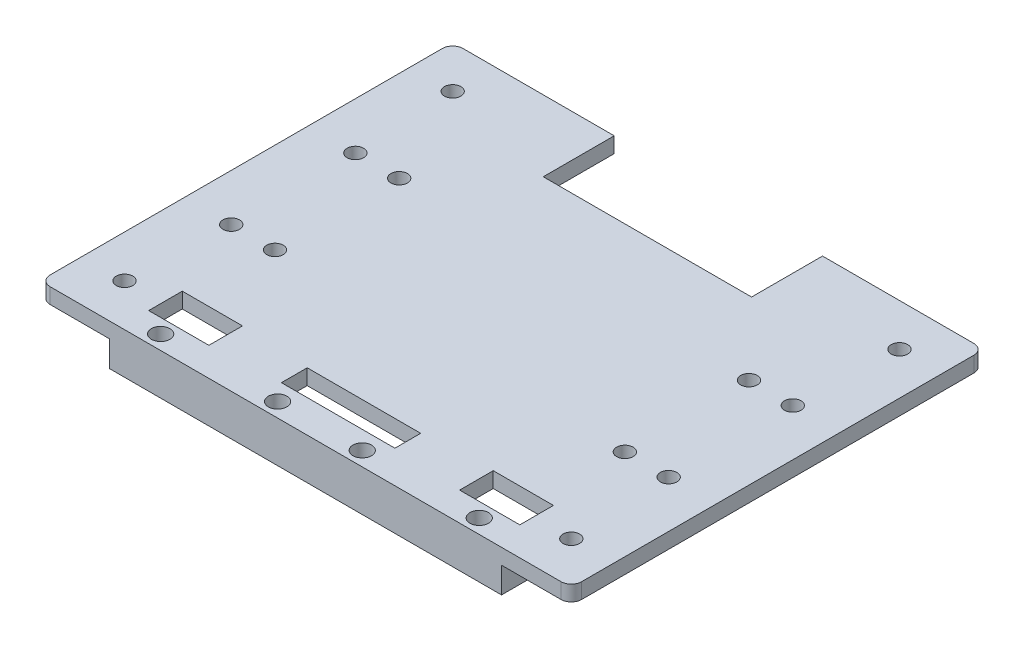
from build123d import *

# Parameters (mm, degrees)
SKETCH_1_R          = 1.6
SKETCH_1_W          = 11.667697598
SKETCH_1_H          = 6.517356375
SKETCH_1_W_2        = 22
SKETCH_1_H_2        = 5
EXTRUDE_1_DEPTH     = 3
SKETCH_2_W          = 75.93825213
SKETCH_2_H          = 5.545458332
EXTRUDE_2_DEPTH     = 8
SKETCH_3_R          = 1.8
CUT_EXTRUDE_1_DEPTH = 15


with BuildPart() as part:
    # 草图1 → 凸台-拉伸1 (new body)
    with BuildSketch(Plane(origin=(0, 0, 0), x_dir=(1, 0, 0), z_dir=(0, 1, 0))):
        with BuildLine():
            Line((-49.5, -40), (49.5, -40))
            ThreePointArc((49.5, -40), (50.914213562, -39.414213562), (51.5, -38))
            Line((51.5, -38), (51.5, 38))
            ThreePointArc((51.5, 38), (50.914213562, 39.414213562), (49.5, 40))
            Line((49.5, 40), (20.187430173, 40))
            Line((20.187430173, 40), (20.187430173, 26.249140852))
            Line((20.187430173, 26.249140852), (-20.187430173, 26.249140852))
            Line((-20.187430173, 26.249140852), (-20.187430173, 40))
            Line((-20.187430173, 40), (-49.5, 40))
            ThreePointArc((-49.5, 40), (-50.914213562, 39.414213562), (-51.5, 38))
            Line((-51.5, 38), (-51.5, -38))
            ThreePointArc((-51.5, -38), (-50.914213562, -39.414213562), (-49.5, -40))
        make_face()
        with Locations(Location((-43.3, -31.8, 0), (0, 0, 270))):
            Circle(SKETCH_1_R, mode=Mode.SUBTRACT)
        with Locations((-30.135277266, -31.195863481)):
            Rectangle(SKETCH_1_W, SKETCH_1_H, mode=Mode.SUBTRACT)
        with Locations(Location((-42.391806281, -12.03, 0), (0, 0, 270))):
            Circle(SKETCH_1_R, mode=Mode.SUBTRACT)
        with Locations(Location((-33.901806281, -12.03, 0), (0, 0, 270))):
            Circle(SKETCH_1_R, mode=Mode.SUBTRACT)
        with Locations((0, -31.19586348)):
            Rectangle(SKETCH_1_W_2, SKETCH_1_H_2, mode=Mode.SUBTRACT)
        with Locations((30.135277266, -31.195863481)):
            Rectangle(SKETCH_1_W, SKETCH_1_H, mode=Mode.SUBTRACT)
        with Locations(Location((43.3, -31.8, 0), (0, 0, 270))):
            Circle(SKETCH_1_R, mode=Mode.SUBTRACT)
        with Locations(Location((33.901806281, -12.03, 0), (0, 0, 270))):
            Circle(SKETCH_1_R, mode=Mode.SUBTRACT)
        with Locations(Location((42.391806281, -12.03, 0), (0, 0, 270))):
            Circle(SKETCH_1_R, mode=Mode.SUBTRACT)
        with Locations(Location((-42.391806281, 12.03, 0), (0, 0, 270))):
            Circle(SKETCH_1_R, mode=Mode.SUBTRACT)
        with Locations(Location((-33.901806281, 12.03, 0), (0, 0, 270))):
            Circle(SKETCH_1_R, mode=Mode.SUBTRACT)
        with Locations(Location((-43.3, 31.8, 0), (0, 0, 270))):
            Circle(SKETCH_1_R, mode=Mode.SUBTRACT)
        with Locations(Location((33.901806281, 12.03, 0), (0, 0, 270))):
            Circle(SKETCH_1_R, mode=Mode.SUBTRACT)
        with Locations(Location((42.391806281, 12.03, 0), (0, 0, 270))):
            Circle(SKETCH_1_R, mode=Mode.SUBTRACT)
        with Locations(Location((43.3, 31.8, 0), (0, 0, 270))):
            Circle(SKETCH_1_R, mode=Mode.SUBTRACT)
    extrude(amount=EXTRUDE_1_DEPTH)

    # 草图2 → 凸台-拉伸2 (add)
    with BuildSketch(Plane(origin=(0, 3, 0), x_dir=(1, 0, 0), z_dir=(0, 1, 0))):
        with Locations((0, -37.227270834)):
            Rectangle(SKETCH_2_W, SKETCH_2_H)
    extrude(amount=-EXTRUDE_2_DEPTH)

    # 草图3 → 切除-拉伸1 (cut)
    with BuildSketch(Plane(origin=(0, -5, 0), x_dir=(-1, 0, 0), z_dir=(0, -1, 0))):
        with Locations(Location((30.875113943, -37.227270834, 0), (0, 0, 90))):
            Circle(SKETCH_3_R)
        with BuildLine():
            ThreePointArc((10, -37.227270834), (8.2, -35.427270834), (6.4, -37.227270834))
            Line((6.4, -37.227270834), (10, -37.227270834))
        make_face()
        with BuildLine():
            Line((10, -37.227270834), (6.4, -37.227270834))
            ThreePointArc((6.4, -37.227270834), (8.2, -39.027270834), (10, -37.227270834))
        make_face()
        with BuildLine():
            ThreePointArc((-10, -37.227270834), (-8.2, -39.027270834), (-6.4, -37.227270834))
            Line((-6.4, -37.227270834), (-10, -37.227270834))
        make_face()
        with BuildLine():
            Line((-10, -37.227270834), (-6.4, -37.227270834))
            ThreePointArc((-6.4, -37.227270834), (-8.2, -35.427270834), (-10, -37.227270834))
        make_face()
        with Locations(Location((-30.875113943, -37.227270834, 0), (0, 0, 90))):
            Circle(SKETCH_3_R)
    extrude(amount=-CUT_EXTRUDE_1_DEPTH, mode=Mode.SUBTRACT)


solid = part.part
